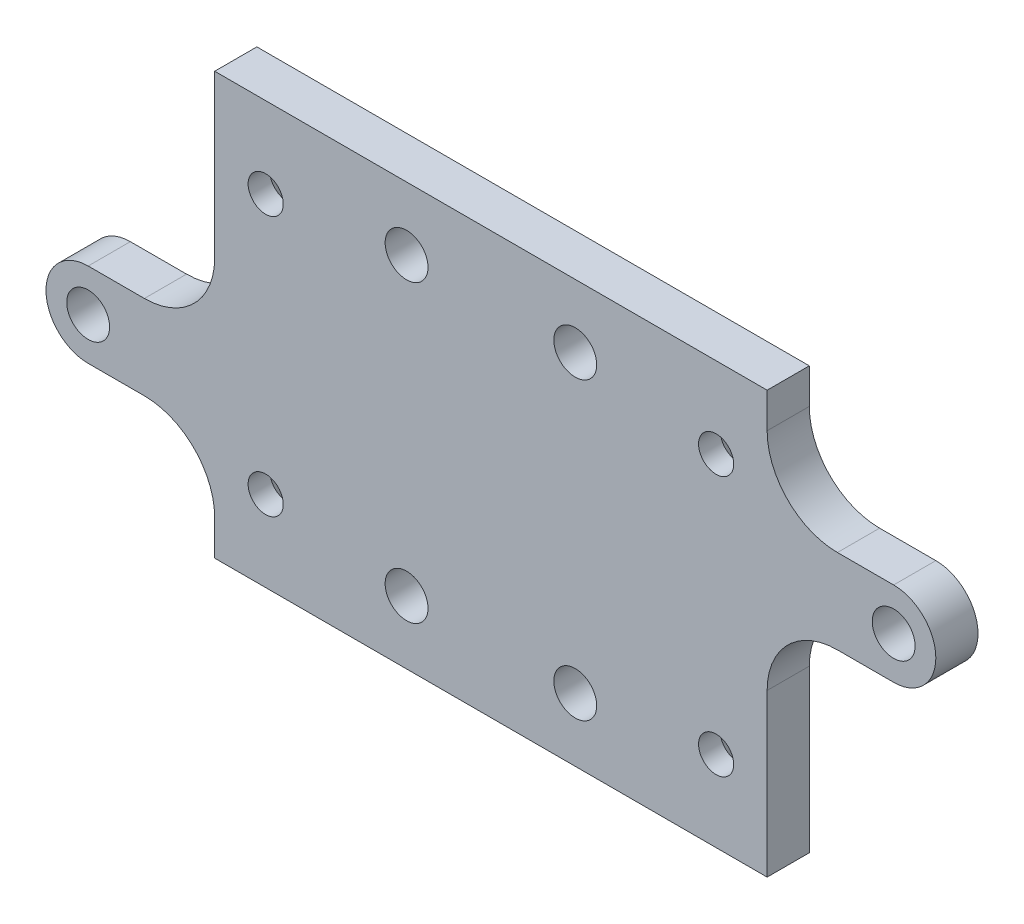
from build123d import *

# Parameters (mm, degrees)
SKETCH_1_W                     = 39.3
SKETCH_1_H                     = 30
EXTRUDE_1_DEPTH                = 3
SKETCH_2_R                     = 1.525
EXTRUDE_2_DEPTH                = 3
SKETCH_4_R                     = 1.525
EXTRUDE_3_DEPTH                = 3
FILLET_1_R                     = 5
SKETCH_5_R                     = 1.525
CUT_EXTRUDE_1_DEPTH            = 30
SKETCH_6_R                     = 1.25
CUT_EXTRUDE_2_DEPTH            = 40
HOLE_WIZARD_M2_5_1_D           = 2.5
HOLE_WIZARD_M2_5_1_CSINK_D     = 5.4
HOLE_WIZARD_M2_5_1_CSINK_ANGLE = 90


with BuildPart() as part:
    # 草图1 → 凸台-拉伸1 (new body)
    with BuildSketch(Plane.XY):
        Rectangle(SKETCH_1_W, SKETCH_1_H)
    extrude(amount=EXTRUDE_1_DEPTH)

    # 草图2 → 凸台-拉伸2 (add)
    with BuildSketch(Plane.XY.offset(3)):
        with BuildLine():
            Line((-28.65, -7.5), (-19.65, -7.5))
            Line((-19.65, -7.5), (-19.65, -1.5))
            Line((-19.65, -1.5), (-28.65, -1.5))
            ThreePointArc((-28.65, -1.5), (-31.65, -4.5), (-28.65, -7.5))
        make_face()
        with Locations((-28.65, -4.5)):
            Circle(SKETCH_2_R, mode=Mode.SUBTRACT)
    extrude(amount=-EXTRUDE_2_DEPTH)

    # 草图4 → 凸台-拉伸3 (add)
    with BuildSketch(Plane.XY.offset(3)):
        with BuildLine():
            Line((28.65, 7.5), (19.65, 7.5))
            Line((19.65, 7.5), (19.65, 1.5))
            Line((19.65, 1.5), (28.65, 1.5))
            ThreePointArc((28.65, 1.5), (31.65, 4.5), (28.65, 7.5))
        make_face()
        with Locations((28.65, 4.5)):
            Circle(SKETCH_4_R, mode=Mode.SUBTRACT)
    extrude(amount=-EXTRUDE_3_DEPTH)

    # 圆角1
    fillet_1_edges = [part.edges().sort_by_distance(p)[0] for p in [
        (-19.65, -1.5, 1.5),
        (-19.65, -7.5, 1.5),
        (19.65, 1.5, 1.5),
        (19.65, 7.5, 1.5),
    ]]
    fillet(fillet_1_edges, radius=FILLET_1_R)

    # 草图5 → 切除-拉伸1 (cut)
    with BuildSketch(Plane.XY.offset(3)):
        with Locations((6, 10.5)):
            Circle(SKETCH_5_R)
        with Locations((-6, 10.5)):
            Circle(SKETCH_5_R)
        with Locations((-6, -10.5)):
            Circle(SKETCH_5_R)
        with Locations((6, -10.5)):
            Circle(SKETCH_5_R)
    extrude(amount=-CUT_EXTRUDE_1_DEPTH, mode=Mode.SUBTRACT)

    # 草图6 → 切除-拉伸2 (cut)
    with BuildSketch(Plane(origin=(0, 0, 0), x_dir=(-1, 0, 0), z_dir=(0, 0, -1))):
        with Locations((16.02146997, 9.25)):
            Circle(SKETCH_6_R)
        with Locations((-16.02146997, -9.25)):
            Circle(SKETCH_6_R)
        with Locations((16.02146997, -9.25)):
            Circle(SKETCH_6_R)
        with Locations((-16.02146997, 9.25)):
            Circle(SKETCH_6_R)
    extrude(amount=-CUT_EXTRUDE_2_DEPTH, mode=Mode.SUBTRACT)

    # M2.5 十字槽半沉头木螺钉的锥形沉头孔1 (through all)
    with Locations(Plane(origin=(0, 0, 0), x_dir=(-1, 0, 0), z_dir=(0, 0, -1))):
        with Locations((-16.02146997, 9.25), (-16.02146997, -9.25), (16.02146997, 9.25), (16.02146997, -9.25)):
            CounterSinkHole(HOLE_WIZARD_M2_5_1_D / 2, HOLE_WIZARD_M2_5_1_CSINK_D / 2, counter_sink_angle=HOLE_WIZARD_M2_5_1_CSINK_ANGLE)


solid = part.part
